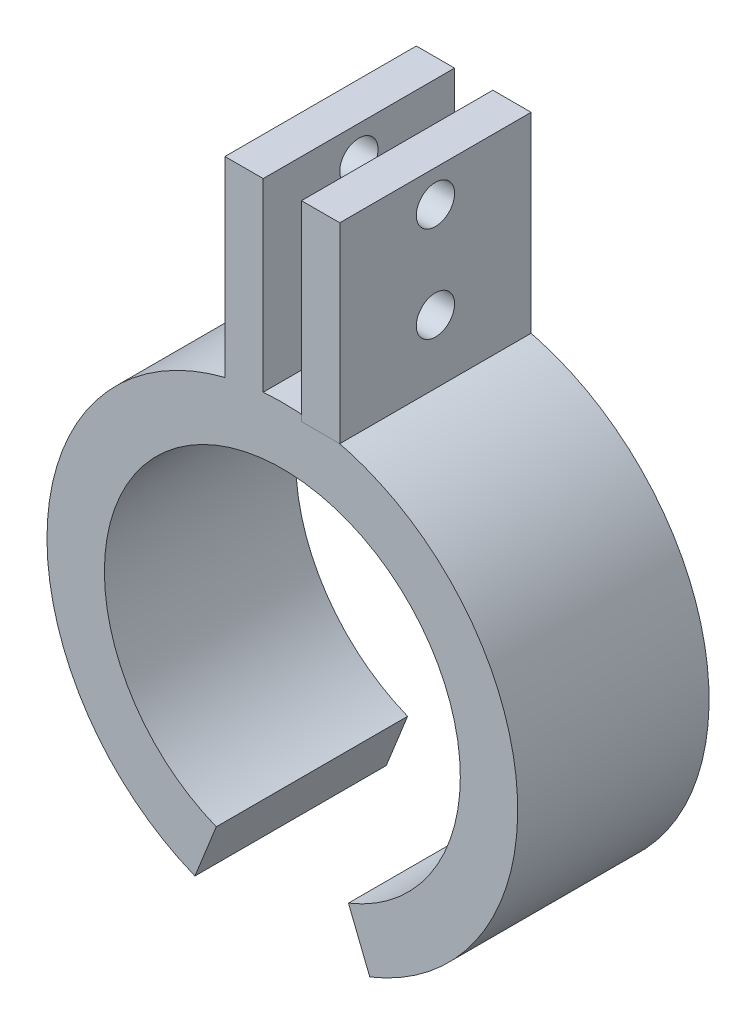
from build123d import *

# Parameters (mm, degrees)
EXTRUDE_THIN1_DEPTH     = 10
SKETCH3_W               = 2
SKETCH3_H               = 10
EXTRUDE_THIN2_DEPTH     = 10
SKETCH4_W               = 2
SKETCH4_H               = 10
EXTRUDE_THIN3_DEPTH     = 10
CUT_EXTRUDE1_DEPTH      = 29.547342157
CUT_EXTRUDE1_DEPTH_BACK = 29.547342157
SKETCH5_R               = 1


with BuildPart() as part:
    # Sketch1 → Extrude-Thin1 (new body)
    with BuildSketch(Plane.XY):
        with BuildLine():
            ThreePointArc((3.45393329, -8.634833225), (0, 9.3), (-3.45393329, -8.634833225))
            Line((-3.45393329, -8.634833225), (-4.568105319, -11.420263298))
            ThreePointArc((-4.568105319, -11.420263298), (0, 12.3), (4.568105319, -11.420263298))
            Line((4.568105319, -11.420263298), (3.45393329, -8.634833225))
        make_face()
    extrude(amount=EXTRUDE_THIN1_DEPTH)

    # Sketch3 → Extrude-Thin2 (add)
    with BuildSketch(Plane.XY.offset(10)):
        with Locations((-2, 16.928537211)):
            Rectangle(SKETCH3_W, SKETCH3_H)
    extrude(amount=-EXTRUDE_THIN2_DEPTH)


with BuildPart() as body_2:
    # Sketch4 → Extrude-Thin3 (new body)
    with BuildSketch(Plane.XY):
        with Locations((2, 16.928537211)):
            Rectangle(SKETCH4_W, SKETCH4_H)
    extrude(amount=EXTRUDE_THIN3_DEPTH)


with BuildPart() as cut_extrude1_tool:
    # Sketch5 → Cut-Extrude1 (new, two sides: drawn at the far end of the back side and taken through both)
    with BuildSketch(Plane.ZY.offset(3).offset(-CUT_EXTRUDE1_DEPTH_BACK)):
        with Locations((5, 20.259282198)):
            Circle(SKETCH5_R)
        with Locations((5, 15.259282198)):
            Circle(SKETCH5_R)
    extrude(amount=CUT_EXTRUDE1_DEPTH + CUT_EXTRUDE1_DEPTH_BACK)


with BuildPart() as part_1:
    add(part.part)

    # Cut-Extrude1: cut by cut_extrude1_tool
    add(cut_extrude1_tool.part, mode=Mode.SUBTRACT)


with BuildPart() as body_2_1:
    add(body_2.part)

    # Cut-Extrude1: cut by cut_extrude1_tool
    add(cut_extrude1_tool.part, mode=Mode.SUBTRACT)


solid = Compound([part_1.part, body_2_1.part])
